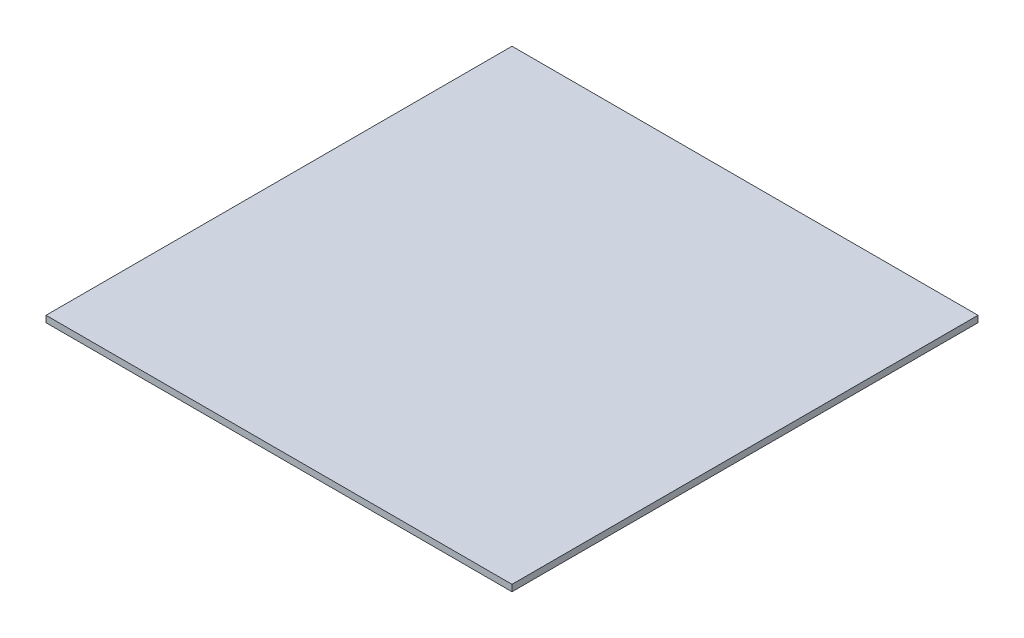
from build123d import *

# Parameters (mm, degrees)
SKETCH1_W           = 1800
SKETCH1_H           = 1800
BOSS_EXTRUDE1_DEPTH = 25


with BuildPart() as part:
    # Sketch1 → Boss-Extrude1 (new body)
    with BuildSketch(Plane(origin=(0, 0, 0), x_dir=(1, 0, 0), z_dir=(0, 1, 0))):
        Rectangle(SKETCH1_W, SKETCH1_H)
    extrude(amount=BOSS_EXTRUDE1_DEPTH)


solid = part.part
